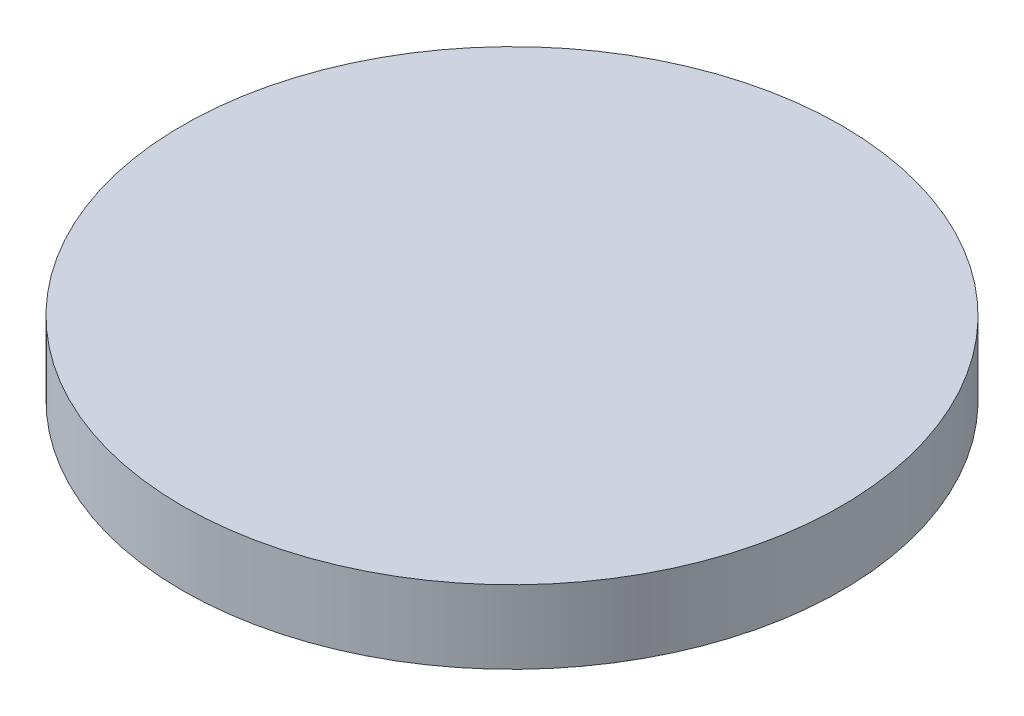
from build123d import *

# Parameters (mm, degrees)
SKETCH1_R           = 85.725
BOSS_EXTRUDE1_DEPTH = 19.05


with BuildPart() as part:
    # Sketch1 → Boss-Extrude1 (new body)
    with BuildSketch(Plane(origin=(0, 0, 0), x_dir=(1, 0, 0), z_dir=(0, 1, 0))):
        with Locations(Location((0, 0, 0), (0, 0, 90))):
            Circle(SKETCH1_R)
    extrude(amount=BOSS_EXTRUDE1_DEPTH)


solid = part.part
